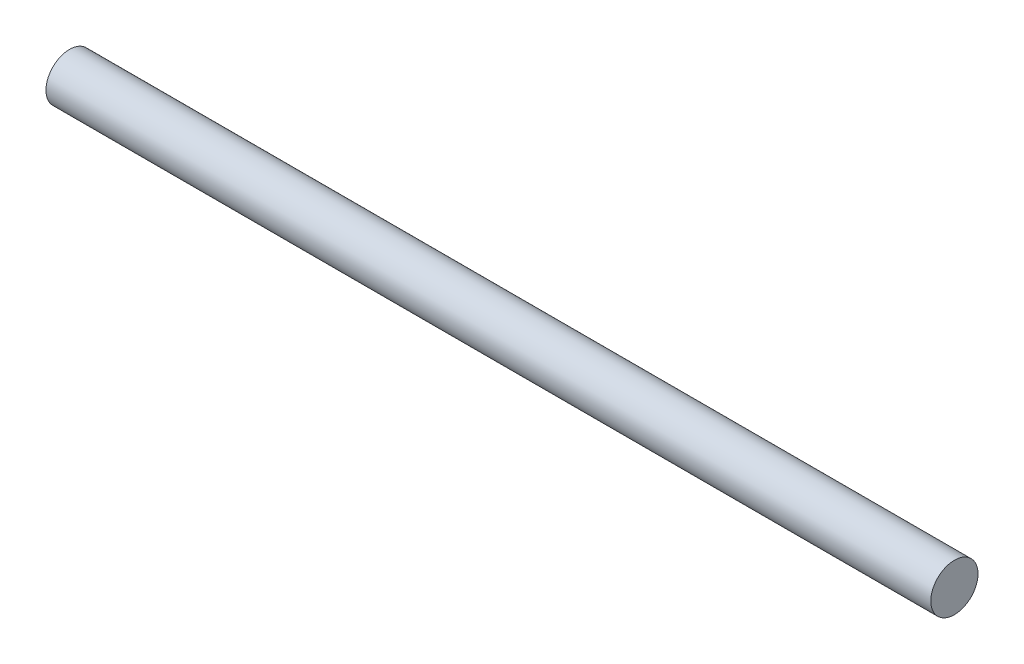
from build123d import *

# Parameters (mm, degrees)
SKETCH1_R           = 4
BOSS_EXTRUDE1_DEPTH = 150


with BuildPart() as part:
    # Sketch1 → Boss-Extrude1 (new body)
    with BuildSketch(Plane(origin=(0, 0, 0), x_dir=(0, 0, -1), z_dir=(1, 0, 0))):
        Circle(SKETCH1_R)
    extrude(amount=BOSS_EXTRUDE1_DEPTH)


solid = part.part
